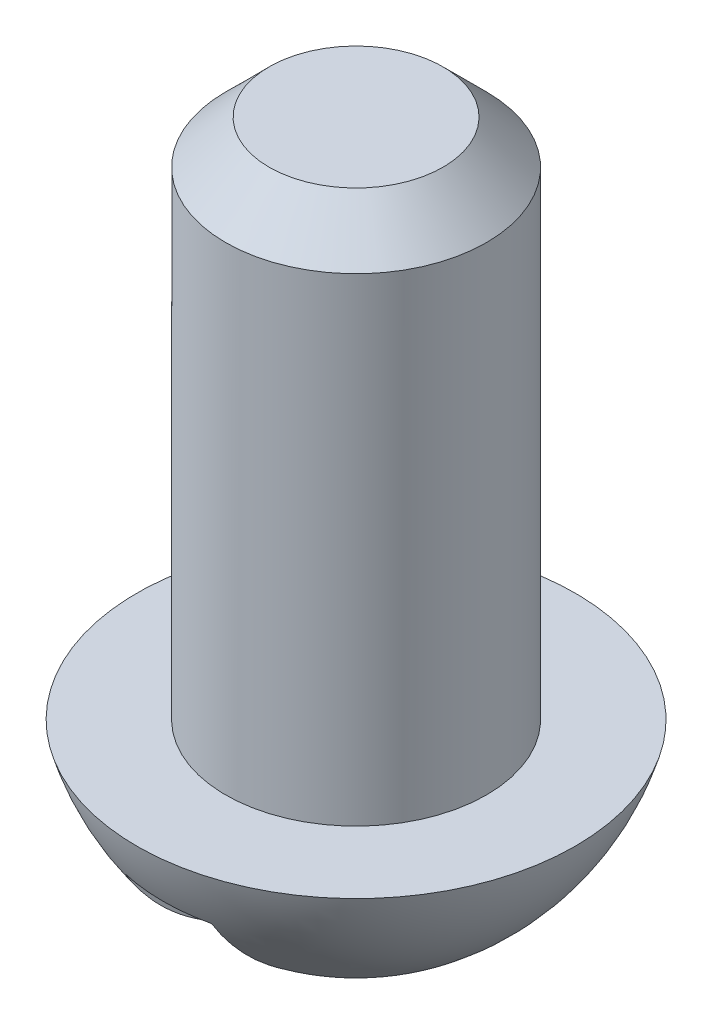
from build123d import *

# Parameters (mm, degrees)
SKETCH1_R               = 1.5
BOSS_EXTRUDE1_DEPTH     = 6
CUT_EXTRUDE1_DEPTH      = 7.97859592
CUT_EXTRUDE1_DEPTH_BACK = 7.97859592
CHAMFER1_SIZE           = 0.5


with BuildPart() as part:
    # Sketch1 → Boss-Extrude1 (new body)
    with BuildSketch(Plane(origin=(0, 0, 0), x_dir=(1, 0, 0), z_dir=(0, 1, 0))):
        with Locations(Location((0, 0, 0), (0, 0, 270))):
            Circle(SKETCH1_R)
    extrude(amount=BOSS_EXTRUDE1_DEPTH)

    # Sketch2 → Revolve1 (revolve)
    with BuildSketch(Plane.XY, mode=Mode.PRIVATE) as revolve1_sk:
        with BuildLine():
            Line((0, 0), (-2.52, 0))
            ThreePointArc((-2.52, 0), (-1.585449748, -1.440539697), (0, -2.1))
            Line((0, -2.1), (0, 0))
        make_face()
    revolve(revolve1_sk.sketch.rotate(Axis((0, -2.1, 0), (0, 1, 0)), 180), axis=Axis((0, -2.1, 0), (0, 1, 0)))

    # Sketch3 → Cut-Extrude1 (cut, two sides: drawn at the far end of the back side and taken through both)
    with BuildSketch(Plane.XY.offset(-CUT_EXTRUDE1_DEPTH_BACK)):
        Polygon((-0.5, -0.7), (0, -0.7), (0.5, -0.7), (0.5, -4.6380618), (-0.5, -4.6380618), align=None)
    extrude(amount=CUT_EXTRUDE1_DEPTH + CUT_EXTRUDE1_DEPTH_BACK, mode=Mode.SUBTRACT)

    # Chamfer1
    chamfer1_edges = [part.edges().sort_by_distance(p)[0] for p in [
        (0, 6, -1.5),
    ]]
    chamfer(chamfer1_edges, length=CHAMFER1_SIZE)


solid = part.part
